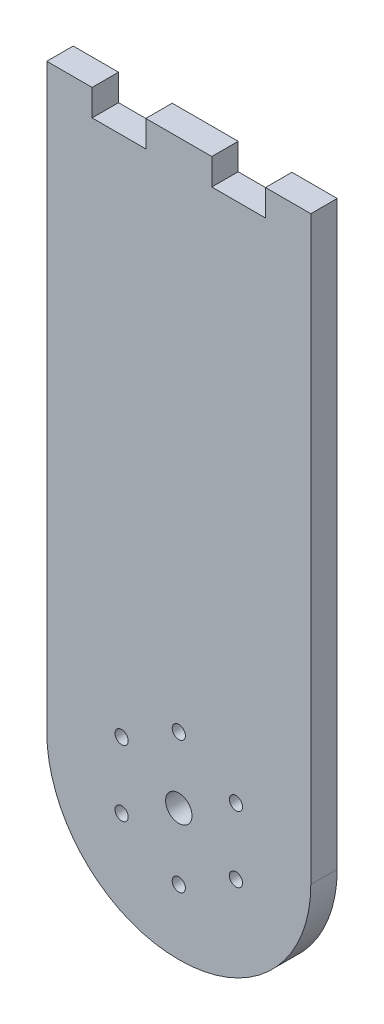
from build123d import *

# Parameters (mm, degrees)
SKETCH2_R           = 0.75
SKETCH2_R_2         = 1.5
BOSS_EXTRUDE1_DEPTH = 3


with BuildPart() as part:
    # Sketch2 → Boss-Extrude1 (new body)
    with BuildSketch(Plane.XY):
        with BuildLine():
            Line((-9.85, 40.45), (-9.85, 37.45))
            Line((-9.85, 37.45), (-3.75, 37.45))
            Line((-3.75, 37.45), (-3.75, 40.45))
            Line((-3.75, 40.45), (3.75, 40.45))
            Line((3.75, 40.45), (3.75, 37.45))
            Line((3.75, 37.45), (9.85, 37.45))
            Line((9.85, 37.45), (9.85, 40.45))
            Line((9.85, 40.45), (15, 40.45))
            Line((15, 40.45), (15, -25.55))
            ThreePointArc((15, -25.55), (10.63589104, -36.08589104), (0.1, -40.45))
            Line((0.1, -40.45), (-0.1, -40.45))
            ThreePointArc((-0.1, -40.45), (-10.63589104, -36.08589104), (-15, -25.55))
            Line((-15, -25.55), (-15, 40.45))
            Line((-15, 40.45), (-9.85, 40.45))
        make_face()
        with Locations((0, -18.05)):
            Circle(SKETCH2_R, mode=Mode.SUBTRACT)
        with Locations((6.495190528, -21.8)):
            Circle(SKETCH2_R, mode=Mode.SUBTRACT)
        with Locations((6.495190528, -29.3)):
            Circle(SKETCH2_R, mode=Mode.SUBTRACT)
        with Locations((0, -33.05)):
            Circle(SKETCH2_R, mode=Mode.SUBTRACT)
        with Locations((-6.495190528, -29.3)):
            Circle(SKETCH2_R, mode=Mode.SUBTRACT)
        with Locations((-6.495190528, -21.8)):
            Circle(SKETCH2_R, mode=Mode.SUBTRACT)
        with Locations((0, -25.55)):
            Circle(SKETCH2_R_2, mode=Mode.SUBTRACT)
    extrude(amount=BOSS_EXTRUDE1_DEPTH)


solid = part.part
